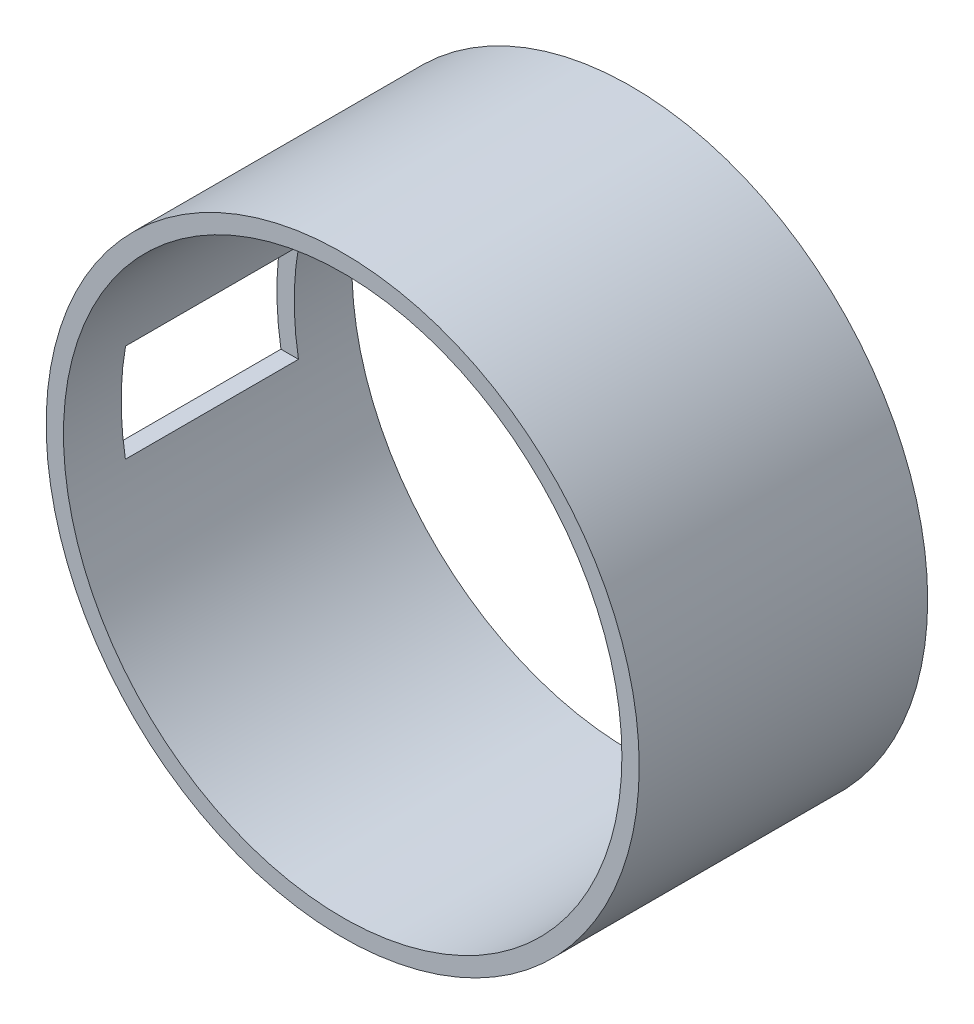
from build123d import *

# Parameters (mm, degrees)
SKETCH_1_R          = 10.28
SKETCH_1_R_2        = 9.68
EXTRUDE_1_DEPTH     = 10
SKETCH_3_W          = 6
SKETCH_3_H          = 3.4
CUT_EXTRUDE_1_DEPTH = 1.5


with BuildPart() as part:
    # 草图1 → 凸台-拉伸1 (new body)
    with BuildSketch(Plane.XY):
        Circle(SKETCH_1_R)
        Circle(SKETCH_1_R_2, mode=Mode.SUBTRACT)
    extrude(amount=EXTRUDE_1_DEPTH)

    # 草图3 → 切除-拉伸1 (cut)
    with BuildSketch(Plane.ZY.offset(10.28)):
        with Locations((5, 0.014841624)):
            Rectangle(SKETCH_3_W, SKETCH_3_H)
    extrude(amount=-CUT_EXTRUDE_1_DEPTH, mode=Mode.SUBTRACT)


solid = part.part
